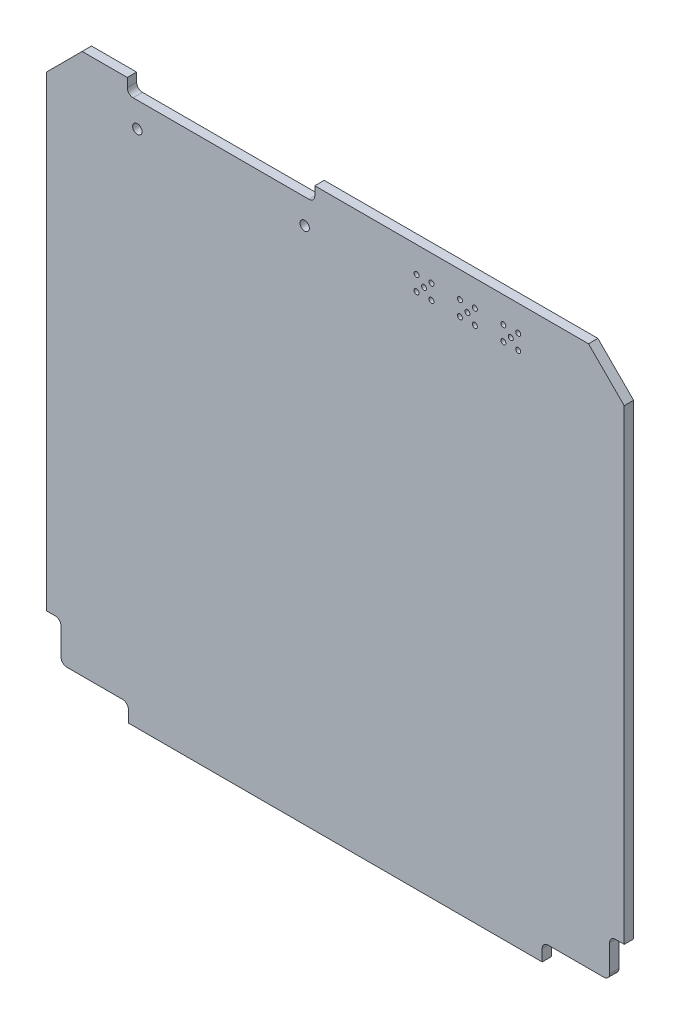
from build123d import *

# Parameters (mm, degrees)
SKETCH1_R           = 0.425
SKETCH1_R_2         = 0.8
BOSS_EXTRUDE1_DEPTH = 1.6


with BuildPart() as part:
    # Sketch1 → Boss-Extrude1 (new body)
    with BuildSketch(Plane(origin=(0, 0, -0.0125), x_dir=(-1, 0, 0), z_dir=(0, 0, -1))):
        with BuildLine():
            Line((35.3, -50), (35.3, -48))
            ThreePointArc((35.3, -48), (35.592893219, -47.292893219), (36.3, -47))
            Line((36.3, -47), (45.8, -47))
            ThreePointArc((45.8, -47), (46.507106781, -46.707106781), (46.8, -46))
            Line((46.8, -46), (46.8, -41.4))
            ThreePointArc((46.8, -41.4), (47.092893219, -40.692893219), (47.8, -40.4))
            Line((47.8, -40.4), (49.3, -40.4))
            Line((49.3, -40.4), (49.3, 39.2))
            Line((49.3, 39.2), (43.2, 45.3))
            Line((43.2, 45.3), (35.500000002, 45.3))
            Line((35.500000002, 45.3), (35.500000002, 43.8))
            ThreePointArc((35.500000002, 43.8), (35.207106783, 43.092893219), (34.500000002, 42.8))
            Line((34.500000002, 42.8), (4.499999998, 42.8))
            ThreePointArc((4.499999998, 42.8), (3.792893217, 43.092893219), (3.499999998, 43.8))
            Line((3.499999998, 43.8), (3.499999998, 45.3))
            Line((3.499999998, 45.3), (-43.2, 45.3))
            Line((-43.2, 45.3), (-49.3, 39.2))
            Line((-49.3, 39.2), (-49.3, -40.4))
            Line((-49.3, -40.4), (-47.8, -40.4))
            ThreePointArc((-47.8, -40.4), (-47.092893219, -40.692893219), (-46.8, -41.4))
            Line((-46.8, -41.4), (-46.8, -46))
            ThreePointArc((-46.8, -46), (-46.507106781, -46.707106781), (-45.8, -47))
            Line((-45.8, -47), (-36.3, -47))
            ThreePointArc((-36.3, -47), (-35.592893219, -47.292893219), (-35.3, -48))
            Line((-35.3, -48), (-35.3, -50))
            Line((-35.3, -50), (35.3, -50))
        make_face()
        with Locations(Location((-21.27, 40.87, 0), (0, 0, 180))):
            Circle(SKETCH1_R, mode=Mode.SUBTRACT)
        with Locations(Location((-23.81, 40.87, 0), (0, 0, 180))):
            Circle(SKETCH1_R, mode=Mode.SUBTRACT)
        with Locations(Location((-22.54, 39.6, 0), (0, 0, 180))):
            Circle(SKETCH1_R, mode=Mode.SUBTRACT)
        with Locations(Location((-13.87, 40.87, 0), (0, 0, 180))):
            Circle(SKETCH1_R, mode=Mode.SUBTRACT)
        with Locations(Location((-23.81, 38.33, 0), (0, 0, 180))):
            Circle(SKETCH1_R, mode=Mode.SUBTRACT)
        with Locations(Location((-16.41, 40.87, 0), (0, 0, 180))):
            Circle(SKETCH1_R, mode=Mode.SUBTRACT)
        with Locations(Location((-15.14, 39.6, 0), (0, 0, 180))):
            Circle(SKETCH1_R, mode=Mode.SUBTRACT)
        with Locations(Location((-21.27, 38.33, 0), (0, 0, 180))):
            Circle(SKETCH1_R, mode=Mode.SUBTRACT)
        with Locations(Location((-28.67, 40.87, 0), (0, 0, 180))):
            Circle(SKETCH1_R, mode=Mode.SUBTRACT)
        with Locations(Location((-31.21, 40.87, 0), (0, 0, 180))):
            Circle(SKETCH1_R, mode=Mode.SUBTRACT)
        with Locations(Location((-16.41, 38.33, 0), (0, 0, 180))):
            Circle(SKETCH1_R, mode=Mode.SUBTRACT)
        with Locations(Location((-29.94, 39.6, 0), (0, 0, 180))):
            Circle(SKETCH1_R, mode=Mode.SUBTRACT)
        with Locations(Location((-31.21, 38.33, 0), (0, 0, 180))):
            Circle(SKETCH1_R, mode=Mode.SUBTRACT)
        with Locations(Location((-28.67, 38.33, 0), (0, 0, 180))):
            Circle(SKETCH1_R, mode=Mode.SUBTRACT)
        with Locations(Location((33.775, 38.54, 0), (0, 0, 180))):
            Circle(SKETCH1_R_2, mode=Mode.SUBTRACT)
        with Locations((5.225, 38.54)):
            Circle(SKETCH1_R_2, mode=Mode.SUBTRACT)
        with Locations(Location((-13.87, 38.33, 0), (0, 0, 180))):
            Circle(SKETCH1_R, mode=Mode.SUBTRACT)
    extrude(amount=-BOSS_EXTRUDE1_DEPTH)


solid = part.part
